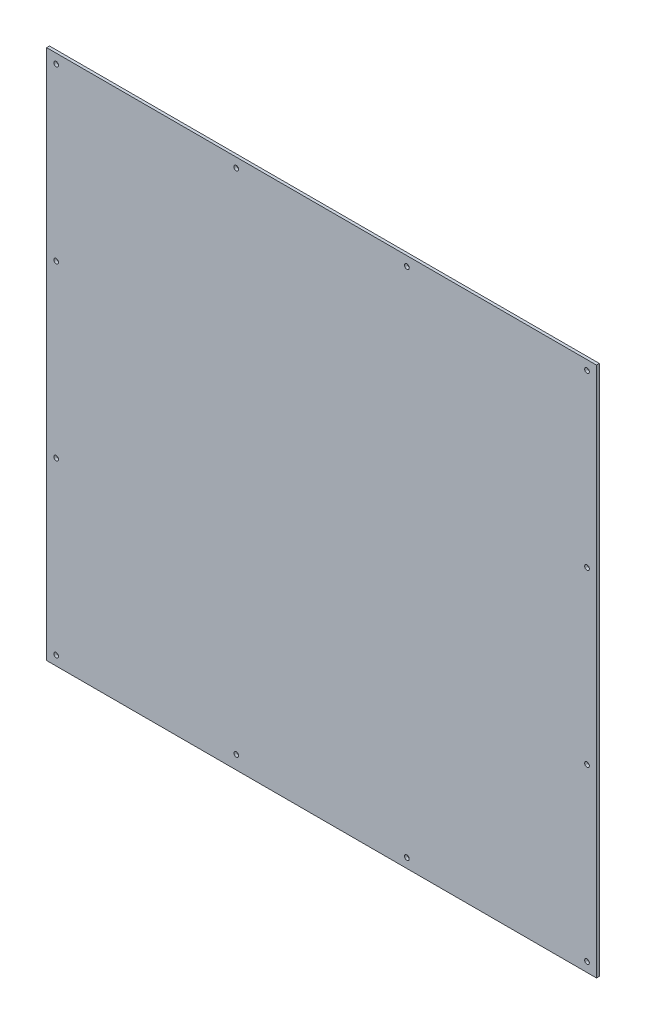
from build123d import *

# Parameters (mm, degrees)
SKETCH2_W           = 580
SKETCH2_H           = 560
BOSS_EXTRUDE1_DEPTH = 3
SKETCH3_R           = 2.5
CUT_EXTRUDE1_DEPTH  = 463.057803372


with BuildPart() as part:
    # Sketch2 → Boss-Extrude1 (new body)
    with BuildSketch(Plane.XY):
        with Locations((70.441640379, 9.085173502)):
            Rectangle(SKETCH2_W, SKETCH2_H)
    extrude(amount=BOSS_EXTRUDE1_DEPTH)

    # Sketch3 → Cut-Extrude1 (cut, through all)
    with BuildSketch(Plane.XY.offset(3)):
        with Locations((-209.558359621, 279.085173502)):
            Circle(SKETCH3_R)
        with Locations((-209.558359621, 99.085173502)):
            Circle(SKETCH3_R)
        with Locations((-209.558359621, -260.914826498)):
            Circle(SKETCH3_R)
        with Locations((-209.558359621, -80.914826498)):
            Circle(SKETCH3_R)
        with Locations((350.441640379, 279.085173502)):
            Circle(SKETCH3_R)
        with Locations((350.441640379, 99.085173502)):
            Circle(SKETCH3_R)
        with Locations((350.441640379, -80.914826498)):
            Circle(SKETCH3_R)
        with Locations((350.441640379, -260.914826498)):
            Circle(SKETCH3_R)
        with Locations((-19.558359621, -256.625367839)):
            Circle(SKETCH3_R)
        with Locations((160.441640379, -260.914826498)):
            Circle(SKETCH3_R)
        with Locations((-19.558359621, 279.085173502)):
            Circle(SKETCH3_R)
        with Locations((160.441640379, 279.085173502)):
            Circle(SKETCH3_R)
    extrude(amount=-CUT_EXTRUDE1_DEPTH, mode=Mode.SUBTRACT)


solid = part.part
